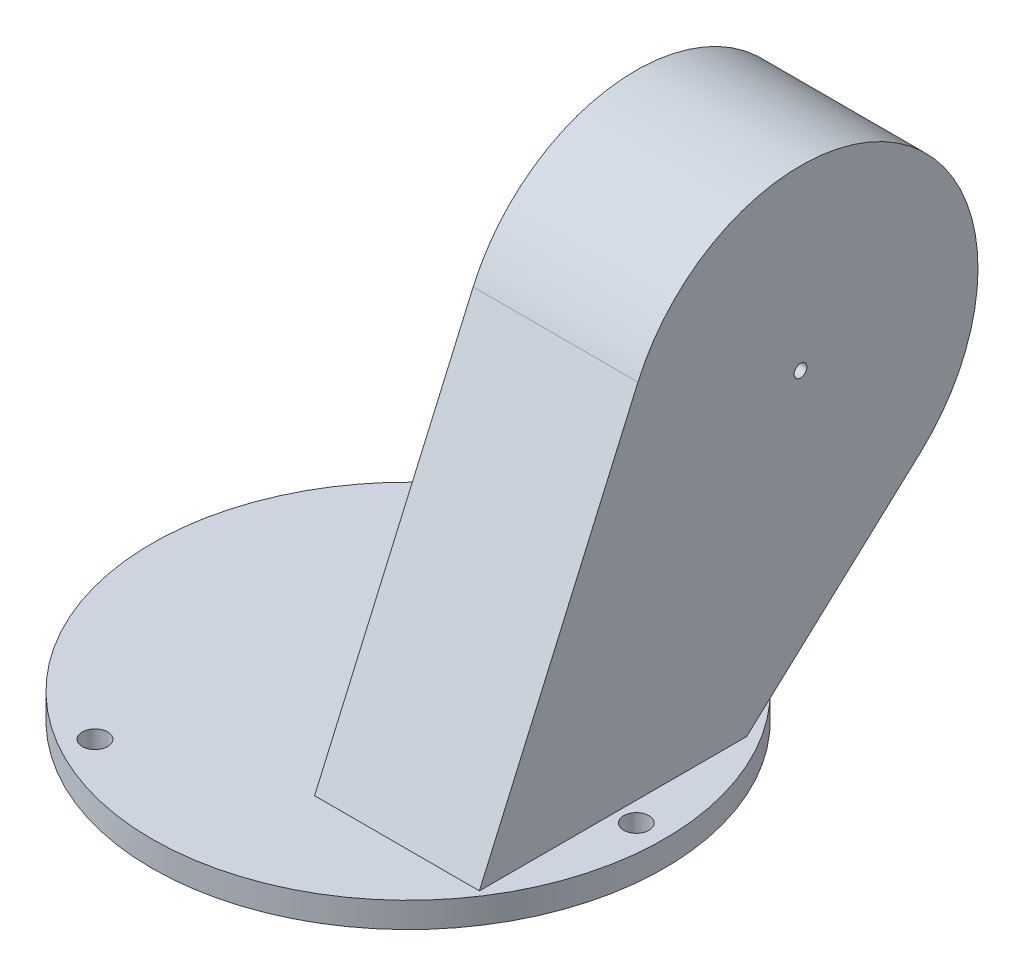
from build123d import *

# Parameters (mm, degrees)
SKETCH_1_R               = 101
EXTRUDE_1_DEPTH          = 10
SKETCH_2_R               = 5
CUT_EXTRUDE_1_DEPTH      = 144.185194765
PATTERN_CIRCULAR_1_COUNT = 3
SKETCH_4_W               = 2.176372913
SKETCH_4_H               = 3.886380203
EXTRUDE_2_DEPTH          = 10
EXTRUDE_3_DEPTH          = 65
CUT_EXTRUDE_2_REACH      = 270.441
SKETCH_6_R               = 2.5
SKETCH_7_R               = 15
EXTRUDE_4_DEPTH          = 3
SKETCH_8_R               = 2.5
CUT_EXTRUDE_3_DEPTH      = 3
SKETCH_9_W               = 6.543349856
SKETCH_9_H               = 10.764234758
CUT_EXTRUDE_4_DEPTH      = 10


with BuildPart() as part:
    # 草图1 → 凸台-拉伸1 (new body)
    with BuildSketch(Plane(origin=(0, 0, 0), x_dir=(1, 0, 0), z_dir=(0, 1, 0))):
        with Locations(Location((0, 0, 0), (0, 0, 270))):
            Circle(SKETCH_1_R)
    extrude(amount=EXTRUDE_1_DEPTH)

    # 草图2 → 切除-拉伸1 (cut, through all)
    with BuildSketch(Plane(origin=(0, 10, 0), x_dir=(1, 0, 0), z_dir=(0, 1, 0))):
        with Locations(Location((90, 0, 0), (0, 0, 270))):
            Circle(SKETCH_2_R)
    cut_extrude_1 = extrude(amount=-CUT_EXTRUDE_1_DEPTH, mode=Mode.SUBTRACT)

    # 阵列(圆周)1: 切除-拉伸1 ×3 about axis
    pattern_circular_1_axis = Axis((-0.221108491, 0, 0), (0, 1, 0))
    for i in range(1, PATTERN_CIRCULAR_1_COUNT):
        add(cut_extrude_1.rotate(pattern_circular_1_axis, i * 360 / PATTERN_CIRCULAR_1_COUNT), mode=Mode.SUBTRACT)

    # 草图4 → 凸台-拉伸2 (add)
    with BuildSketch(Plane(origin=(0, 10, 0), x_dir=(1, 0, 0), z_dir=(0, 1, 0))):
        with Locations((98.327159319, -0.022531505)):
            Rectangle(SKETCH_4_W, SKETCH_4_H)
    extrude(amount=EXTRUDE_2_DEPTH)

    # 草图5 → 凸台-拉伸3 (add)
    with BuildSketch(Plane.ZY.offset(-82.238972862)):
        with BuildLine():
            Line((-119.770908646, 72.705399825), (-51.25005009, 10))
            Line((-51.25005009, 10), (54.128166527, 10))
            Line((54.128166527, 10), (-8.416959639, 152.482035135))
            ThreePointArc((-8.416959639, 152.482035135), (-113.280560411, 181.249471787), (-119.770908646, 72.705399825))
        make_face()
    extrude(amount=EXTRUDE_3_DEPTH)

    # 草图6 → 切除-拉伸2 (cut, up to next)
    with BuildSketch(Plane.ZY.offset(-17.238972862), mode=Mode.PRIVATE) as cut_extrude_2_sk1:
        with Locations((-72.513360124, 124.345733942)):
            Circle(SKETCH_6_R)
    cut_extrude_2_tool1 = extrude(cut_extrude_2_sk1.sketch, amount=-CUT_EXTRUDE_2_REACH, mode=Mode.PRIVATE) & part.part
    add(cut_extrude_2_tool1.solids().sort_by_distance((17.238973, 124.345734, -72.51336))[0], mode=Mode.SUBTRACT)

    # 草图7 → 凸台-拉伸4 (add)
    with BuildSketch(Plane.ZY.offset(-17.238972862)):
        with Locations((-72.513360124, 124.345733942)):
            Circle(SKETCH_7_R)
    extrude(amount=EXTRUDE_4_DEPTH)

    # 草图8 → 切除-拉伸3 (cut)
    with BuildSketch(Plane.ZY.offset(-14.238972862)):
        with Locations((-72.513360124, 124.345733942)):
            Circle(SKETCH_8_R)
    extrude(amount=-CUT_EXTRUDE_3_DEPTH, mode=Mode.SUBTRACT)

    # 草图9 → 切除-拉伸4 (cut)
    with BuildSketch(Plane(origin=(99.415345775, 0, 0), x_dir=(0, 0, -1), z_dir=(1, 0, 0))):
        with Locations((0.262028791, 15.382117379)):
            Rectangle(SKETCH_9_W, SKETCH_9_H)
    extrude(amount=-CUT_EXTRUDE_4_DEPTH, mode=Mode.SUBTRACT)


solid = part.part
